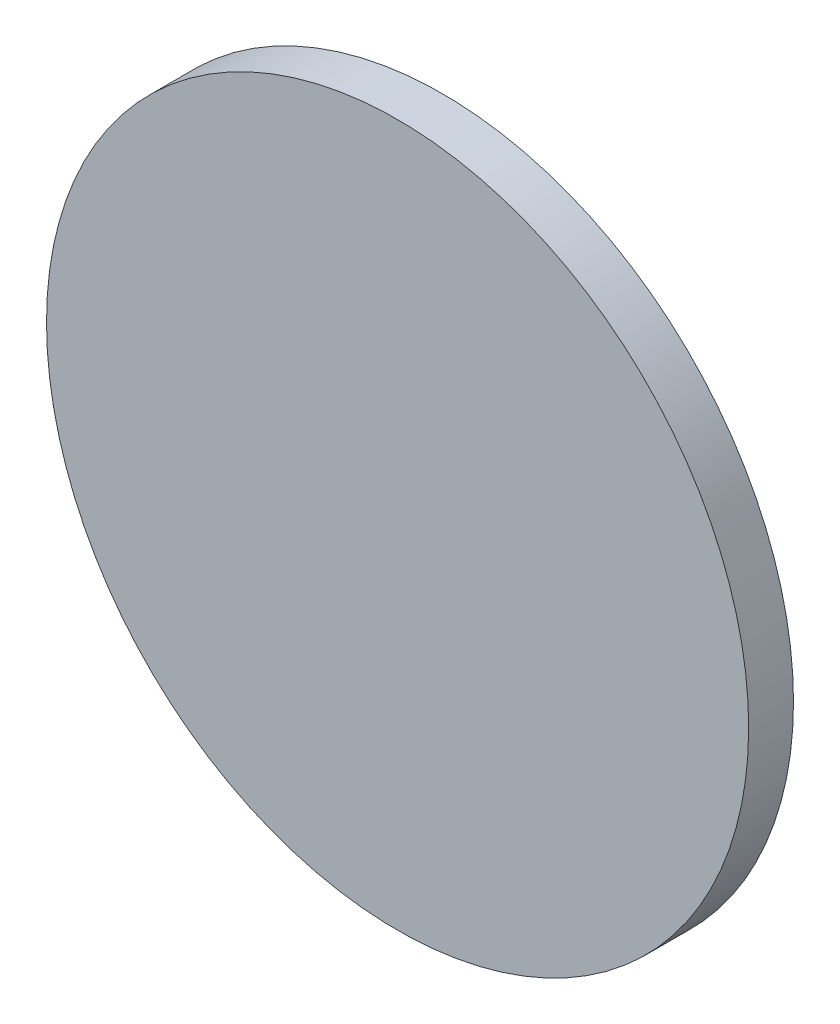
from build123d import *

# Parameters (mm, degrees)
SKETCH1_R           = 117.5
BOSS_EXTRUDE1_DEPTH = 15


with BuildPart() as part:
    # Sketch1 → Boss-Extrude1 (new body)
    with BuildSketch(Plane.XY):
        Circle(SKETCH1_R)
    extrude(amount=BOSS_EXTRUDE1_DEPTH)


solid = part.part
